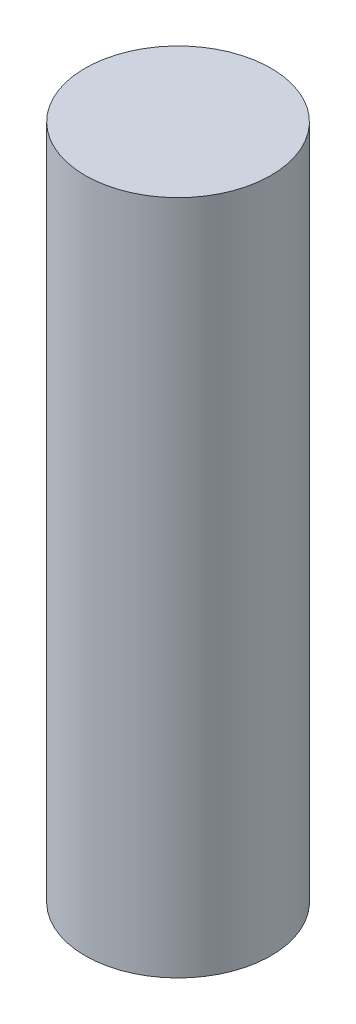
from build123d import *

# Parameters (mm, degrees)
SKETCH2_R           = 27.5
BOSS_EXTRUDE1_DEPTH = 100


with BuildPart() as part:
    # Sketch2 → Boss-Extrude1 (new, symmetric)
    with BuildSketch(Plane(origin=(0, 0, 0), x_dir=(1, 0, 0), z_dir=(0, 1, 0))):
        with Locations(Location((0, 0, 0), (0, 0, 270))):
            Circle(SKETCH2_R)
    extrude(amount=BOSS_EXTRUDE1_DEPTH, both=True)


solid = part.part
